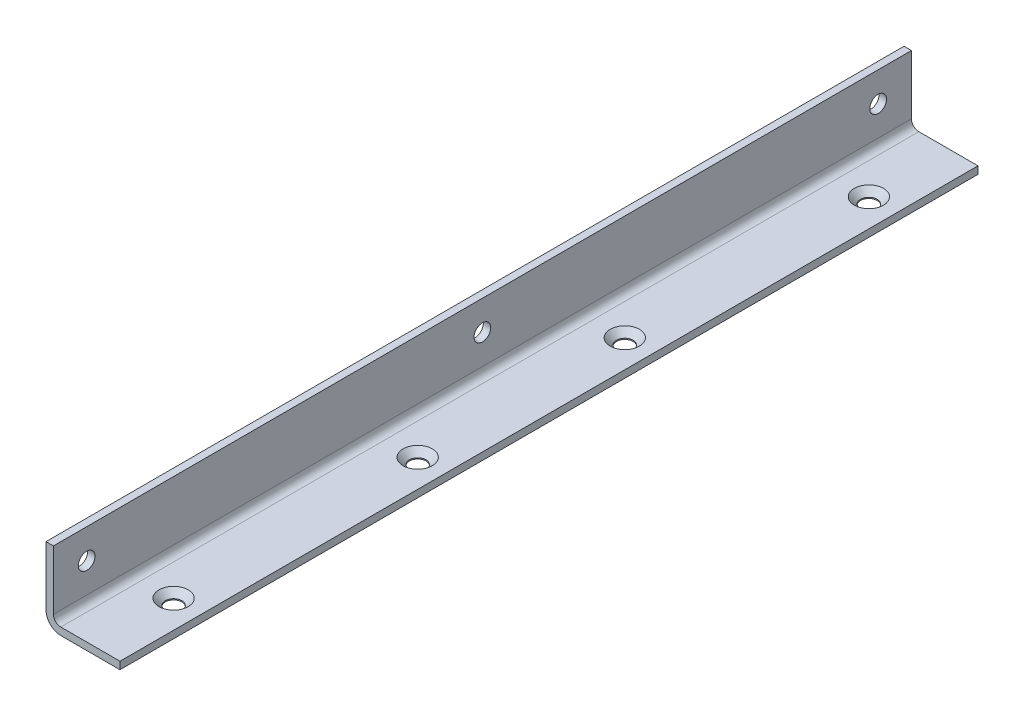
from build123d import *

# Parameters (mm, degrees)
EXTRUDE_1_DEPTH     = 232
SKETCH_2_R          = 2.25
CUT_EXTRUDE_1_DEPTH = 10
SKETCH_3_R          = 2.25
CUT_EXTRUDE_2_DEPTH = 10
CHAMFER_1_SIZE      = 1.7
FILLET_1_R          = 4


with BuildPart() as part:
    # Эскиз1 → Вытянуть1 (new body)
    with BuildSketch(Plane.XY):
        with BuildLine():
            Line((0, 0), (20, 0))
            Line((20, 0), (20, 2))
            Line((20, 2), (4, 2))
            ThreePointArc((4, 2), (2.585786438, 2.585786438), (2, 4))
            Line((2, 4), (2, 20))
            Line((2, 20), (0, 20))
            Line((0, 20), (0, 0))
        make_face()
    extrude(amount=EXTRUDE_1_DEPTH)

    # Эскиз2 → Вырез-Вытянуть1 (cut)
    with BuildSketch(Plane(origin=(2, 0, 0), x_dir=(0, 0, -1), z_dir=(1, 0, 0))):
        with Locations((-223, 12)):
            Circle(SKETCH_2_R)
        with Locations((-9, 12)):
            Circle(SKETCH_2_R)
        with Locations((-116, 12)):
            Circle(SKETCH_2_R)
    extrude(amount=-CUT_EXTRUDE_1_DEPTH, mode=Mode.SUBTRACT)

    # Эскиз3 → Вырез-Вытянуть2 (cut)
    with BuildSketch(Plane(origin=(0, 2, 0), x_dir=(1, 0, 0), z_dir=(0, 1, 0))):
        with Locations(Location((12.5, -210, 0), (0, 0, 270))):
            Circle(SKETCH_3_R)
        with Locations(Location((12.5, -144, 0), (0, 0, 270))):
            Circle(SKETCH_3_R)
        with Locations(Location((12.5, -22, 0), (0, 0, 270))):
            Circle(SKETCH_3_R)
        with Locations(Location((12.5, -88, 0), (0, 0, 270))):
            Circle(SKETCH_3_R)
    extrude(amount=-CUT_EXTRUDE_2_DEPTH, mode=Mode.SUBTRACT)

    # Фаска1
    chamfer_1_edges = [part.edges().sort_by_distance(p)[0] for p in [
        (12.5, 2, 207.75),
        (12.5, 2, 141.75),
        (12.5, 2, 19.75),
        (12.5, 2, 85.75),
    ]]
    chamfer(chamfer_1_edges, length=CHAMFER_1_SIZE)

    # Скругление1
    fillet_1_edges = [part.edges().sort_by_distance(p)[0] for p in [
        (0, 0, 116),
    ]]
    fillet(fillet_1_edges, radius=FILLET_1_R)


solid = part.part
